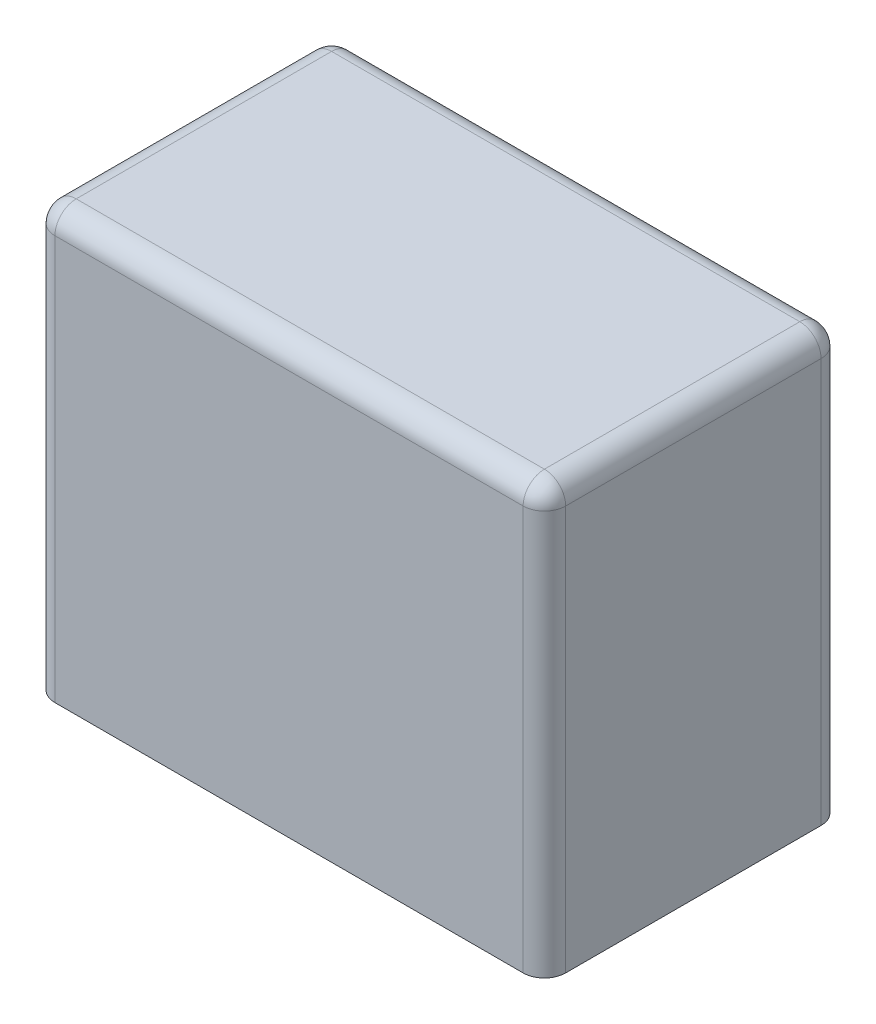
from build123d import *

# Parameters (mm, degrees)
SKETCH1_W           = 24
SKETCH1_H           = 14
BOSS_EXTRUDE1_DEPTH = 20
FILLET1_R           = 1


with BuildPart() as part:
    # Sketch1 → Boss-Extrude1 (new body)
    with BuildSketch(Plane(origin=(0, 0, 0), x_dir=(1, 0, 0), z_dir=(0, 1, 0))):
        Rectangle(SKETCH1_W, SKETCH1_H)
    extrude(amount=BOSS_EXTRUDE1_DEPTH)

    # Fillet1
    fillet1_edges = [part.edges().sort_by_distance(p)[0] for p in [
        (-12, 20, 0),
        (0, 20, 7),
        (12, 20, 0),
        (12, 10, 7),
        (-12, 10, 7),
        (-12, 10, -7),
        (12, 10, -7),
        (0, 20, -7),
    ]]
    fillet(fillet1_edges, radius=FILLET1_R)


solid = part.part
